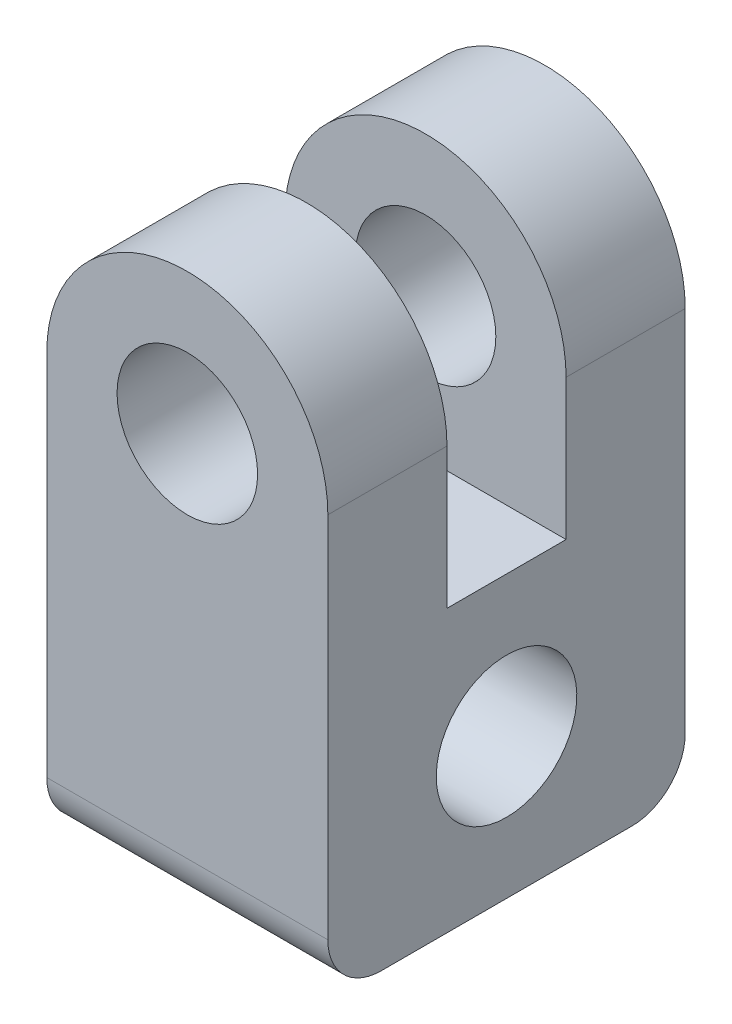
from build123d import *

# Parameters (mm, degrees)
SKETCH1_R           = 26.25
BOSS_EXTRUDE1_DEPTH = 133.5
SKETCH3_R           = 26.25
CUT_EXTRUDE1_DEPTH  = 232.63225164
CUT_EXTRUDE2_START  = -210
CUT_EXTRUDE2_DEPTH  = 105
FILLET1_R           = 20


with BuildPart() as part:
    # Sketch1 → Boss-Extrude1 (new body)
    with BuildSketch(Plane.XY):
        with BuildLine():
            Line((-52.5, 0), (-52.5, -157.5))
            Line((-52.5, -157.5), (52.5, -157.5))
            Line((52.5, -157.5), (52.5, 0))
            ThreePointArc((52.5, 0), (0, 52.5), (-52.5, 0))
        make_face()
        Circle(SKETCH1_R, mode=Mode.SUBTRACT)
    extrude(amount=BOSS_EXTRUDE1_DEPTH)

    # Sketch3 → Cut-Extrude1 (cut, through all)
    with BuildSketch(Plane.ZY.offset(52.5)):
        with Locations(Location((66.75, -105, 0), (0, 0, 270))):
            Circle(SKETCH3_R)
    extrude(amount=-CUT_EXTRUDE1_DEPTH, mode=Mode.SUBTRACT)

    # Sketch6 → Cut-Extrude2 (cut)
    with BuildSketch(Plane.XZ.offset(157.5).offset(CUT_EXTRUDE2_START)):
        Polygon((-52.5, 66.75), (-52.5, 44.5), (52.5, 44.5), (52.5, 89), (-52.5, 89), align=None)
    extrude(amount=CUT_EXTRUDE2_DEPTH, mode=Mode.SUBTRACT)

    # Fillet1
    fillet1_edges = [part.edges().sort_by_distance(p)[0] for p in [
        (0, -157.5, 133.5),
        (0, -157.5, 0),
    ]]
    fillet(fillet1_edges, radius=FILLET1_R)


solid = part.part
